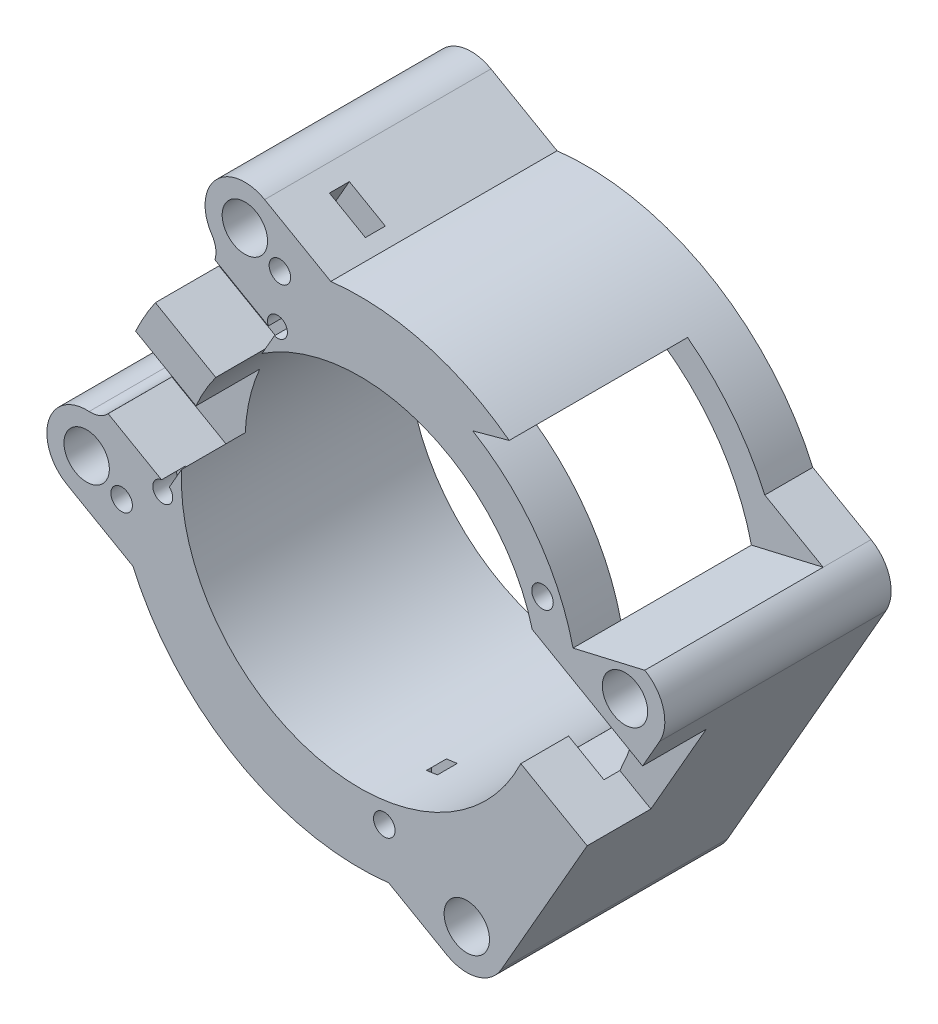
from build123d import *
from build123d.topology import SkipClean

# Parameters (mm, degrees)
SKETCH1_R           = 1.65
BOSS_EXTRUDE1_DEPTH = 28.42
BOSS_EXTRUDE2_START = -6
BOSS_EXTRUDE2_DEPTH = 6
CUT_EXTRUDE1_DEPTH  = 448.984003326
SKETCH2_R           = 1.35
CUT_EXTRUDE2_DEPTH  = 10
CUT_EXTRUDE3_START  = -6
CUT_EXTRUDE3_DEPTH  = 2.5
SKETCH6_R           = 2.85
CUT_EXTRUDE4_DEPTH  = 25.42
CUT_EXTRUDE5_DEPTH  = 8
SKETCH9_R           = 1.25
SKETCH9_R_2         = 0.9
CUT_EXTRUDE6_DEPTH  = 3


with BuildPart() as part:
    # Sketch1 → Boss-Extrude1 (new body)
    with BuildSketch(Plane.XY):
        with BuildLine():
            Line((315.446757744, -209.334375502), (307.145931928, -204.583822928))
            ThreePointArc((307.145931928, -204.583822928), (304.839707487, -198.809610477), (309.94041472, -195.253912751))
            ThreePointArc((309.94041472, -195.253912751), (312.02997255, -194.578904366), (313.099972788, -192.661357044))
            ThreePointArc((313.099972788, -192.661357044), (316.927762492, -181.377375124), (324.717839469, -172.361005417))
            ThreePointArc((324.717839469, -172.361005417), (325.829134231, -170.467090901), (325.352638411, -168.323533116))
            ThreePointArc((325.352638411, -168.323533116), (325.834549562, -162.124503979), (331.981341697, -161.18794269))
            Line((331.981341697, -161.18794269), (340.282167513, -165.938495264))
            ThreePointArc((340.282167513, -165.938495264), (359.367624876, -169.832762492), (372.393242256, -184.315624498))
            Line((372.393242256, -184.315624498), (379.716809958, -188.506893436))
            ThreePointArc((379.716809958, -188.506893436), (382.057949767, -191.534058007), (381.572857005, -195.330022437))
            Line((381.572857005, -195.330022437), (361.70452919, -230.046726627))
            ThreePointArc((361.70452919, -230.046726627), (358.677364619, -232.387866435), (354.881400189, -231.902773674))
            Line((354.881400189, -231.902773674), (347.557832487, -227.711504736))
            ThreePointArc((347.557832487, -227.711504736), (328.472375124, -223.817237508), (315.446757744, -209.334375502))
        make_face()
        with Locations((329.49780072, -165.527530714)):
            Circle(SKETCH1_R, mode=Mode.SUBTRACT)
        with Locations((309.629472905, -200.244234904)):
            Circle(SKETCH1_R, mode=Mode.SUBTRACT)
        with Locations((357.364941166, -227.56318565)):
            Circle(SKETCH1_R, mode=Mode.SUBTRACT)
        with Locations((377.233268981, -192.84648146)):
            Circle(SKETCH1_R, mode=Mode.SUBTRACT)
        with BuildLine():
            Line((350.381017272, -175.377033761), (358.116585638, -173.27278235))
            ThreePointArc((358.116585638, -173.27278235), (370.455744319, -189.606671008), (368.091003881, -209.940356319))
            Line((368.091003881, -209.940356319), (360.355435515, -212.044607729))
            ThreePointArc((360.355435515, -212.044607729), (322.305430082, -202.70465707), (350.381017272, -175.377033761))
        make_face(mode=Mode.SUBTRACT)
    extrude(amount=BOSS_EXTRUDE1_DEPTH)

    # Sketch3 → Boss-Extrude2 (add)
    with SkipClean():  # the faces are left unmerged after this step: merging them gives an invalid solid
        with BuildSketch(Plane.XY.offset(28.42).offset(BOSS_EXTRUDE2_START)):
            with BuildLine():
                Line((350.381017272, -175.377033761), (358.116585638, -173.27278235))
                ThreePointArc((358.116585638, -173.27278235), (370.455744319, -189.606671008), (368.091003881, -209.940356319))
                Line((368.091003881, -209.940356319), (360.355435515, -212.044607729))
                ThreePointArc((360.355435515, -212.044607729), (365.534569918, -190.94534293), (350.381017272, -175.377033761))
            make_face()
        extrude(amount=BOSS_EXTRUDE2_DEPTH)

    # Sketch4 → Cut-Extrude1 (cut, through all)
    with SkipClean():  # the faces are left unmerged after this step: merging them gives an invalid solid
        with BuildSketch(Plane.XY.offset(6.02)):
            with BuildLine():
                Line((358.116585638, -173.27278235), (362.690804567, -172.028490247))
                ThreePointArc((362.690804567, -172.028490247), (368.327855438, -177.551531373), (372.393242256, -184.315624498))
                Line((372.393242256, -184.315624498), (379.716809958, -188.506893436))
                Line((379.716809958, -188.506893436), (370.706331874, -190.60065869))
                ThreePointArc((370.706331874, -190.60065869), (366.167779812, -180.660647448), (358.116585638, -173.27278235))
            make_face()
        extrude(amount=CUT_EXTRUDE1_DEPTH, mode=Mode.SUBTRACT)

    # Sketch2 → Cut-Extrude2 (cut)
    with SkipClean():  # the faces are left unmerged after this step: merging them gives an invalid solid
        with BuildSketch(Plane.XY.offset(28.42)):
            with Locations((333.892058998, -168.042359411)):
                Circle(SKETCH2_R)
            with Locations((366.872927979, -186.917270836)):
                Circle(SKETCH2_R)
            with Locations((347.004600164, -221.633975026)):
                Circle(SKETCH2_R)
            with Locations((314.023731183, -202.759063601)):
                Circle(SKETCH2_R)
        extrude(amount=-CUT_EXTRUDE2_DEPTH, mode=Mode.SUBTRACT)

    # Sketch5 → Cut-Extrude3 (cut)
    with SkipClean():  # the faces are left unmerged after this step: merging them gives an invalid solid
        with BuildSketch(Plane.XY.offset(28.42).offset(CUT_EXTRUDE3_START)):
            Polygon((347.322305423, -218.648611279), (344.578051949, -219.866152326), (344.260346689, -222.851516073), (343.72048979, -227.924360053), (348.891291479, -228.474641704), (349.431148378, -223.401797725), (349.748853638, -220.416433978), align=None)
            Polygon((317.025930942, -202.747664506), (315.514959157, -200.153382795), (312.512759397, -200.16478189), (311.021531424, -202.770462696), (309.283604434, -205.807210317), (313.796775978, -208.390092933), (315.534702968, -205.353345312), align=None)
            Polygon((332.381087213, -165.4480777), (330.889859239, -168.053758506), (332.400831025, -170.648040217), (335.403030784, -170.636641122), (336.894258757, -168.030960316), (338.632185748, -164.994212695), (334.119014203, -162.411330079), align=None)
        extrude(amount=-CUT_EXTRUDE3_DEPTH, mode=Mode.SUBTRACT)

    # Sketch6 → Cut-Extrude4 (cut)
    with SkipClean():  # the faces are left unmerged after this step: merging them gives an invalid solid
        with BuildSketch(Plane.XY.offset(28.42)):
            with Locations((309.629472905, -200.244234904)):
                Circle(SKETCH6_R)
            with Locations((329.49780072, -165.527530714)):
                Circle(SKETCH6_R)
            with Locations((357.364941166, -227.56318565)):
                Circle(SKETCH6_R)
            with Locations((377.233268981, -192.84648146)):
                Circle(SKETCH6_R)
        extrude(amount=-CUT_EXTRUDE4_DEPTH, mode=Mode.SUBTRACT)

    # Sketch7 → Cut-Extrude5 (cut)
    with SkipClean():  # the faces are left unmerged after this step: merging them gives an invalid solid
        with BuildSketch(Plane.XY.offset(28.42)):
            Polygon((314.35069552, -177.022065052), (327.846814274, -184.74587749), (333.310604423, -175.198783838), (319.814485669, -167.4749714), align=None)
            Polygon((311.867154543, -181.361653076), (325.363273297, -189.085465514), (319.899483147, -198.632559166), (306.403364394, -190.908746728), align=None)
            Polygon((362.133329989, -189.159191987), (368.208753158, -192.636149318), (379.437011765, -199.062068137), (372.48309703, -211.212914604), (361.254838422, -204.786995784), (355.179415254, -201.310038454), align=None)
        extrude(amount=-CUT_EXTRUDE5_DEPTH, mode=Mode.SUBTRACT)

    # Sketch9 → Cut-Extrude6 (cut)
    with SkipClean():  # the faces are left unmerged after this step: merging them gives an invalid solid
        with BuildSketch(Plane.XY.offset(28.42)):
            with Locations((333.590333217, -174.206689184)):
                Circle(SKETCH9_R)
            with Locations((331.502572712, -180.270619929)):
                Circle(SKETCH9_R_2)
            with Locations((328.870019276, -184.870583234)):
                Circle(SKETCH9_R_2)
            with Locations((326.388064384, -186.791494453)):
                Circle(SKETCH9_R)
            with Locations((322.661166834, -195.719553293)):
                Circle(SKETCH9_R_2)
            with Locations((319.185795551, -199.376299722)):
                Circle(SKETCH9_R)
        extrude(amount=-CUT_EXTRUDE6_DEPTH, mode=Mode.SUBTRACT)


solid = part.part
